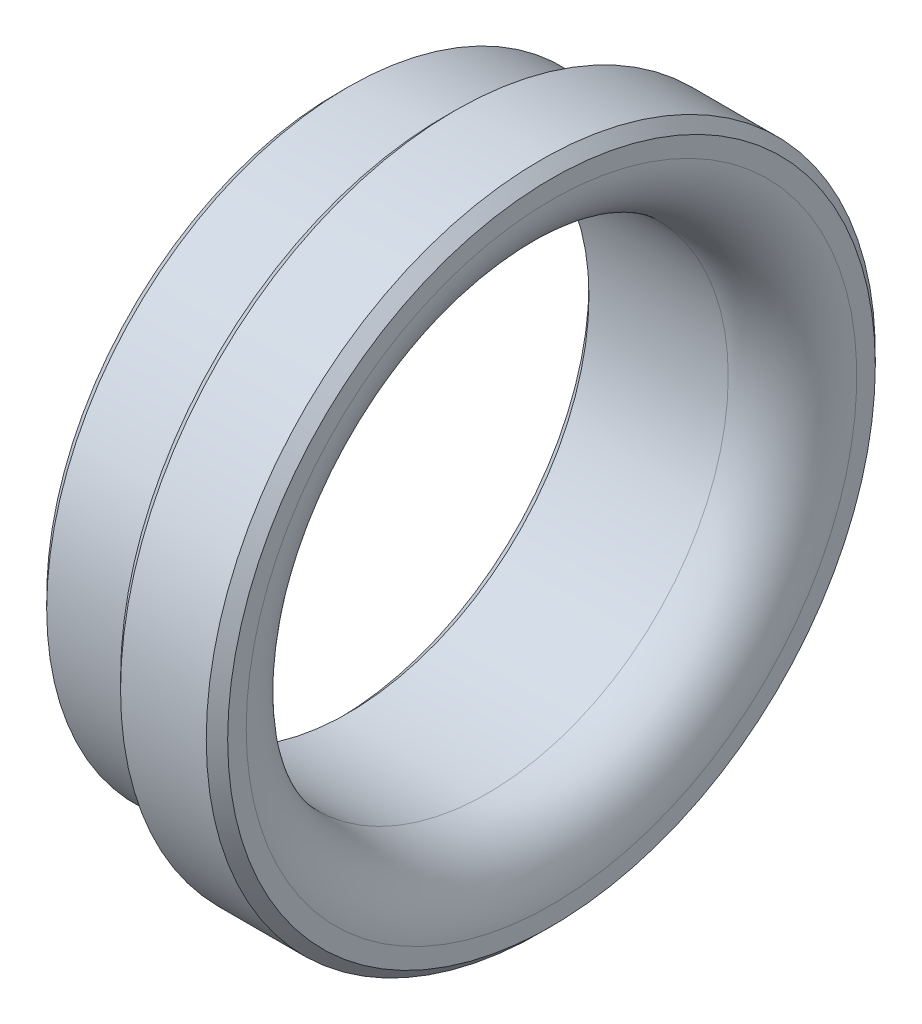
from build123d import *

# Parameters (mm, degrees)
CHAMFER1_SIZE = 1.27
FILLET1_R     = 7.62


with BuildPart() as part:
    # Sketch1 → Revolve1 (revolve)
    with BuildSketch(Plane.XY, mode=Mode.PRIVATE) as revolve1_sk:
        Polygon((0, 28.575), (0, 35.71875), (12.7, 35.71875), (12.7, 39.6621), (25.4, 39.6621), (25.4, 28.575), align=None)
    revolve(revolve1_sk.sketch.rotate(Axis((-88.99, 0, 0), (1, 0, 0)), 90), axis=Axis((-88.99, 0, 0), (1, 0, 0)))

    # Chamfer1
    chamfer1_edges = [part.edges().sort_by_distance(p)[0] for p in [
        (25.4, 0, -39.6621),
        (12.7, 0, -39.6621),
        (0, 0, -35.71875),
        (0, 0, -28.575),
    ]]
    chamfer(chamfer1_edges, length=CHAMFER1_SIZE)

    # Fillet1
    fillet1_edges = [part.edges().sort_by_distance(p)[0] for p in [
        (25.4, 0, -28.575),
    ]]
    fillet(fillet1_edges, radius=FILLET1_R)


solid = part.part
